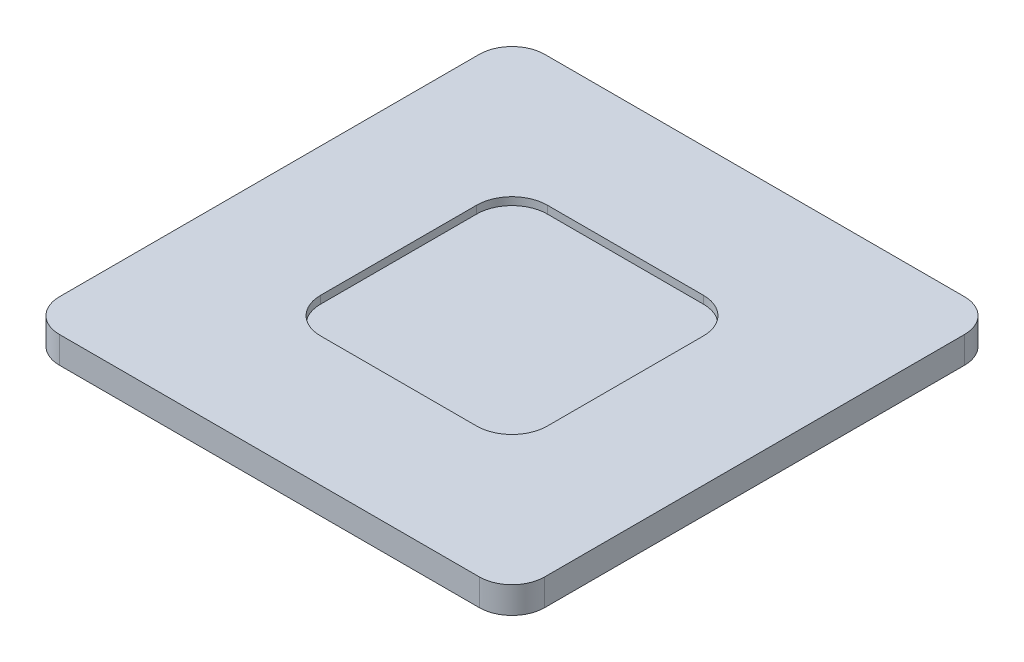
from build123d import *

# Parameters (mm, degrees)
SKETCH3_W           = 47.117
SKETCH3_H           = 47.117
BOSS_EXTRUDE1_DEPTH = 2.5908
FILLET2_R           = 3.175
CUT_EXTRUDE1_DEPTH  = 0.75


with BuildPart() as part:
    # Sketch3 → Boss-Extrude1 (new body)
    with BuildSketch(Plane(origin=(0, 0, 0), x_dir=(1, 0, 0), z_dir=(0, 1, 0))):
        with Locations((23.8125, 23.8125)):
            Rectangle(SKETCH3_W, SKETCH3_H)
    extrude(amount=BOSS_EXTRUDE1_DEPTH)

    # Fillet2
    fillet2_edges = [part.edges().sort_by_distance(p)[0] for p in [
        (0.254, 1.2954, -47.371),
        (47.371, 1.2954, -47.371),
        (47.371, 1.2954, -0.254),
        (0.254, 1.2954, -0.254),
    ]]
    fillet(fillet2_edges, radius=FILLET2_R)

    # Sketch5 → Cut-Extrude1 (cut)
    with BuildSketch(Plane(origin=(0, 2.5908, 0), x_dir=(1, 0, 0), z_dir=(0, 1, 0))):
        with BuildLine():
            Line((31.387499983, 34.816499983), (16.237500017, 34.816499983))
            ThreePointArc((16.237500017, 34.816499983), (13.812830864, 33.812169136), (12.808500017, 31.387499983))
            Line((12.808500017, 31.387499983), (12.808500017, 16.237500017))
            ThreePointArc((12.808500017, 16.237500017), (13.812830864, 13.812830864), (16.237500017, 12.808500017))
            Line((16.237500017, 12.808500017), (31.387499983, 12.808500017))
            ThreePointArc((31.387499983, 12.808500017), (33.812169136, 13.812830864), (34.816499983, 16.237500017))
            Line((34.816499983, 16.237500017), (34.816499983, 31.387499983))
            ThreePointArc((34.816499983, 31.387499983), (33.812169136, 33.812169136), (31.387499983, 34.816499983))
        make_face()
    extrude(amount=-CUT_EXTRUDE1_DEPTH, mode=Mode.SUBTRACT)


solid = part.part
